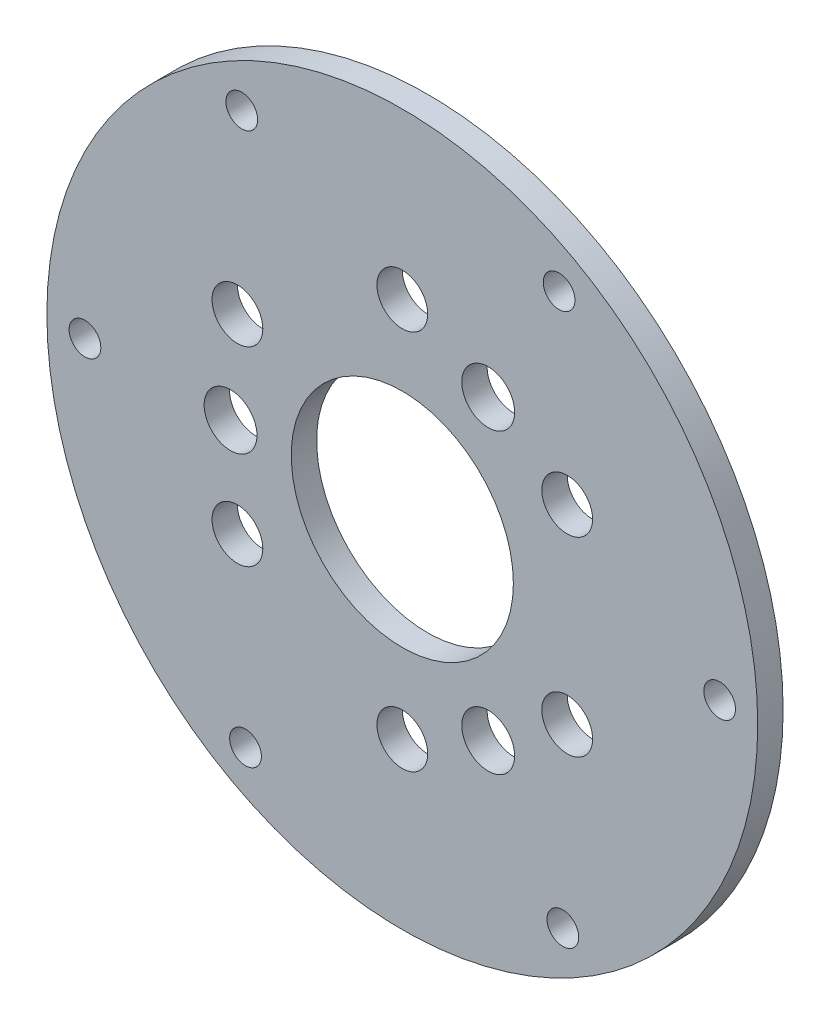
from build123d import *

# Parameters (mm, degrees)
SKETCH_1_R      = 28
SKETCH_1_R_2    = 2
SKETCH_1_R_3    = 2.08
SKETCH_1_R_4    = 8.75
SKETCH_1_R_5    = 1.25
EXTRUDE_1_DEPTH = 2


with BuildPart() as part:
    # 草图1 → 凸台-拉伸1 (new body)
    with BuildSketch(Plane.XY):
        Circle(SKETCH_1_R)
        with Locations((0, -15)):
            Circle(SKETCH_1_R_2, mode=Mode.SUBTRACT)
        with Locations((-12.990381057, -7.5)):
            Circle(SKETCH_1_R_2, mode=Mode.SUBTRACT)
        with Locations((-12.990381057, 7.5)):
            Circle(SKETCH_1_R_2, mode=Mode.SUBTRACT)
        with Locations((0, 15)):
            Circle(SKETCH_1_R_2, mode=Mode.SUBTRACT)
        with Locations((12.990381057, 7.5)):
            Circle(SKETCH_1_R_2, mode=Mode.SUBTRACT)
        with Locations((12.990381057, -7.5)):
            Circle(SKETCH_1_R_2, mode=Mode.SUBTRACT)
        with Locations((-13.53, 0)):
            Circle(SKETCH_1_R_3, mode=Mode.SUBTRACT)
        with Locations((6.765, 11.717323713)):
            Circle(SKETCH_1_R_3, mode=Mode.SUBTRACT)
        with Locations((6.765, -11.717323713)):
            Circle(SKETCH_1_R_3, mode=Mode.SUBTRACT)
        Circle(SKETCH_1_R_4, mode=Mode.SUBTRACT)
        with Locations((12.351862398, 21.735489304)):
            Circle(SKETCH_1_R_5, mode=Mode.SUBTRACT)
        with Locations((24.9994171, 0.170718032)):
            Circle(SKETCH_1_R_5, mode=Mode.SUBTRACT)
        with Locations((12.647554702, -21.564771273)):
            Circle(SKETCH_1_R_5, mode=Mode.SUBTRACT)
        with Locations((-12.351862398, -21.735489304)):
            Circle(SKETCH_1_R_5, mode=Mode.SUBTRACT)
        with Locations((-24.9994171, -0.170718032)):
            Circle(SKETCH_1_R_5, mode=Mode.SUBTRACT)
        with Locations((-12.647554702, 21.564771273)):
            Circle(SKETCH_1_R_5, mode=Mode.SUBTRACT)
    extrude(amount=EXTRUDE_1_DEPTH)


solid = part.part
